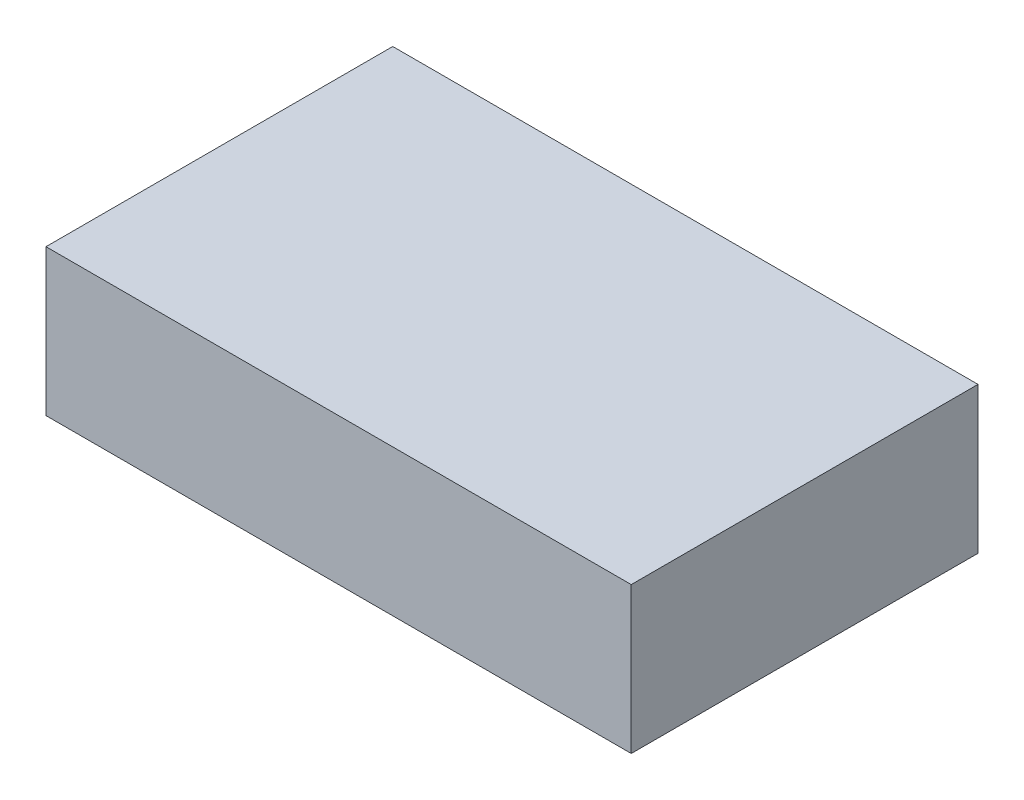
from build123d import *

# Parameters (mm, degrees)
SKETCH1_W           = 40
SKETCH1_H           = 23.7
BOSS_EXTRUDE1_DEPTH = 10


with BuildPart() as part:
    # Sketch1 → Boss-Extrude1 (new body)
    with BuildSketch(Plane(origin=(0, 0, 0), x_dir=(1, 0, 0), z_dir=(0, 1, 0))):
        with Locations((20, 11.85)):
            Rectangle(SKETCH1_W, SKETCH1_H)
    extrude(amount=-BOSS_EXTRUDE1_DEPTH)


solid = part.part
